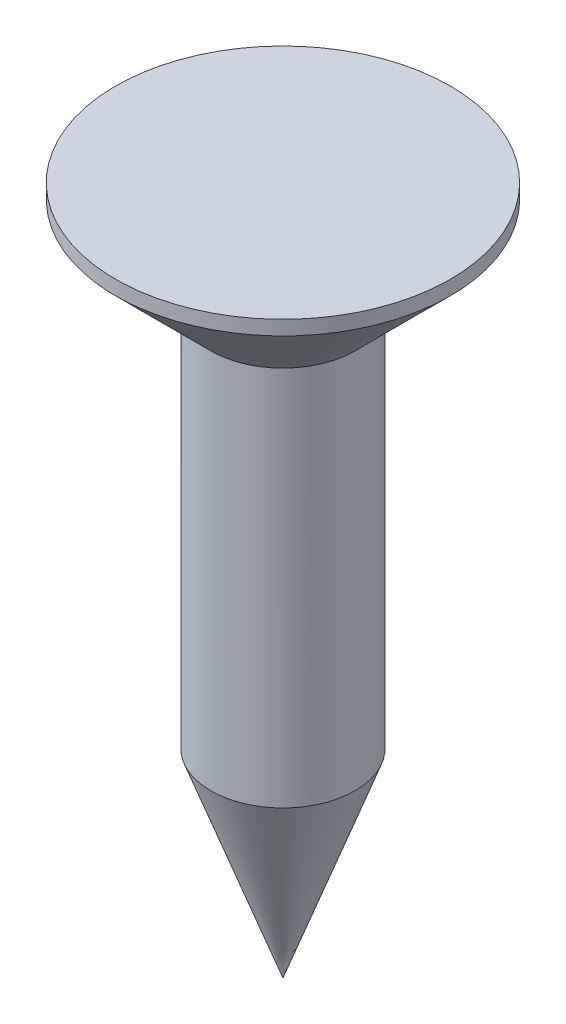
from build123d import *


with BuildPart() as part:
    # Sketch1 → Revolve1 (revolve)
    with BuildSketch(Plane.XY, mode=Mode.PRIVATE) as revolve1_sk:
        Polygon((0, 4.25), (-2.9, 4.25), (-2.9, 4), (-1.25, 2.35), (-1.25, -4.25), (0, -7.684346774), align=None)
    revolve(revolve1_sk.sketch.rotate(Axis((0, -7.684346774, 0), (0, 1, 0)), 270), axis=Axis((0, -7.684346774, 0), (0, 1, 0)))


solid = part.part
